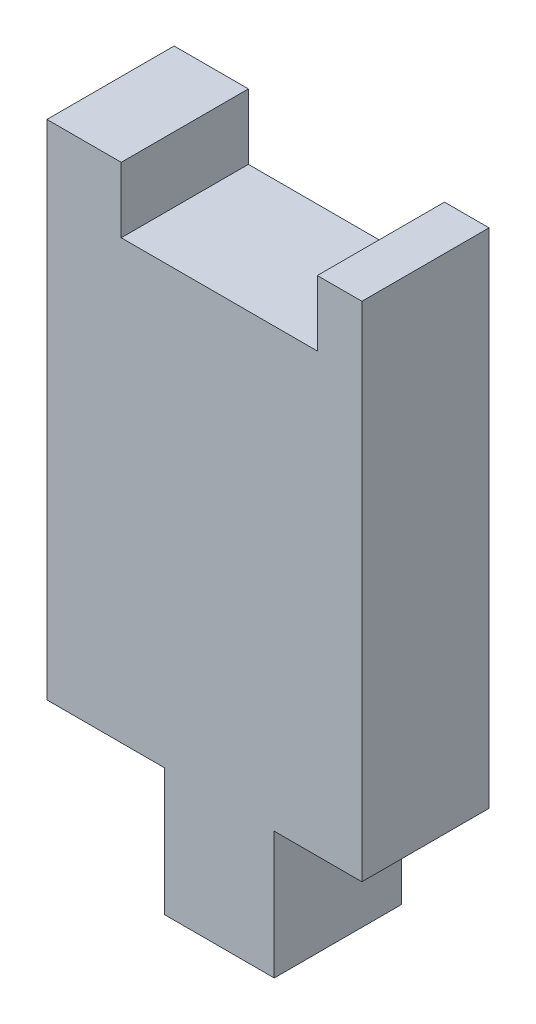
from build123d import *

# Parameters (mm, degrees)
SKETCH1_W           = 12.192
SKETCH1_H           = 24.384
BOSS_EXTRUDE1_DEPTH = 5.4356
SKETCH2_W           = 3.7465
SKETCH2_H           = 5.4356
CUT_EXTRUDE1_DEPTH  = 5.4356
SKETCH3_W           = 1.905
SKETCH3_H           = 2.794
BOSS_EXTRUDE2_DEPTH = 5.4356
SKETCH4_W           = 1.27
SKETCH4_H           = 21.7424
BOSS_EXTRUDE3_DEPTH = 5.4356
SKETCH5_W           = 3.175
SKETCH5_H           = 0.254
SKETCH5_W_2         = 1.905
SKETCH5_W_3         = 8.382
CUT_EXTRUDE2_DEPTH  = 31.279271711


with BuildPart() as part:
    # Sketch1 → Boss-Extrude1 (new body)
    with BuildSketch(Plane.XY):
        with Locations((6.096, 12.192)):
            Rectangle(SKETCH1_W, SKETCH1_H)
    extrude(amount=BOSS_EXTRUDE1_DEPTH)

    # Sketch2 → Cut-Extrude1 (cut)
    with BuildSketch(Plane.XY.offset(5.4356)):
        with Locations((1.87325, 2.7178)):
            Rectangle(SKETCH2_W, SKETCH2_H)
        with Locations((10.31875, 2.7178)):
            Rectangle(SKETCH2_W, SKETCH2_H)
    extrude(amount=-CUT_EXTRUDE1_DEPTH, mode=Mode.SUBTRACT)

    # Sketch3 → Boss-Extrude2 (add)
    with BuildSketch(Plane.XY.offset(5.4356)):
        with Locations((0.9525, 25.781)):
            Rectangle(SKETCH3_W, SKETCH3_H)
        with Locations((11.2395, 25.781)):
            Rectangle(SKETCH3_W, SKETCH3_H)
    extrude(amount=-BOSS_EXTRUDE2_DEPTH)

    # Sketch4 → Boss-Extrude3 (add)
    with BuildSketch(Plane.XY.offset(5.4356)):
        with Locations((-0.635, 16.3068)):
            Rectangle(SKETCH4_W, SKETCH4_H)
    extrude(amount=-BOSS_EXTRUDE3_DEPTH)

    # Sketch5 → Cut-Extrude2 (cut, through all)
    with BuildSketch(Plane.XY.offset(5.4356)):
        with Locations((0.3175, 27.051)):
            Rectangle(SKETCH5_W, SKETCH5_H)
        with Locations((11.2395, 27.051)):
            Rectangle(SKETCH5_W_2, SKETCH5_H)
        with Locations((6.096, 24.257)):
            Rectangle(SKETCH5_W_3, SKETCH5_H)
    extrude(amount=-CUT_EXTRUDE2_DEPTH, mode=Mode.SUBTRACT)


solid = part.part
